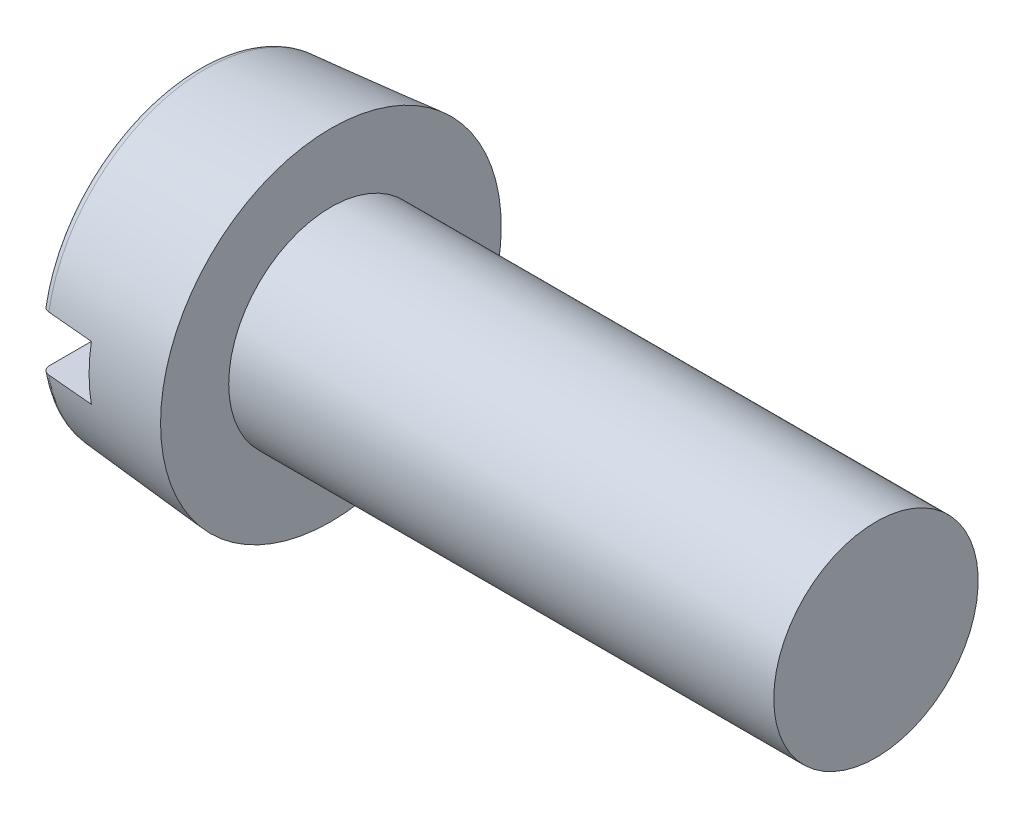
from build123d import *

# Parameters (mm, degrees)
FILLET2_R  = 0.25
SKETCH2_W  = 10
SKETCH2_H  = 1.6
SLOT_DEPTH = 1.6


with BuildPart() as part:
    # BodySke → Base-Revolve (revolve)
    with BuildSketch(Plane.XY, mode=Mode.PRIVATE) as base_revolve_sk:
        Polygon((3.9, 3), (3.9, 5), (0, 4.658794212), (0, 0), (19.9, 0), (19.9, 3), align=None)
    revolve(base_revolve_sk.sketch.rotate(Axis((-25.4, 0, 0), (1, 0, 0)), 90), axis=Axis((-25.4, 0, 0), (1, 0, 0)))

    # Fillet2
    fillet2_edges = [part.edges().sort_by_distance(p)[0] for p in [
        (0, 0, -4.658794212),
    ]]
    fillet(fillet2_edges, radius=FILLET2_R)

    # Sketch2 → Slot (cut)
    with BuildSketch(Plane(origin=(0, 0, 0), x_dir=(0, 0, -1), z_dir=(1, 0, 0))):
        Rectangle(SKETCH2_W, SKETCH2_H)
    extrude(amount=SLOT_DEPTH, mode=Mode.SUBTRACT)


solid = part.part
